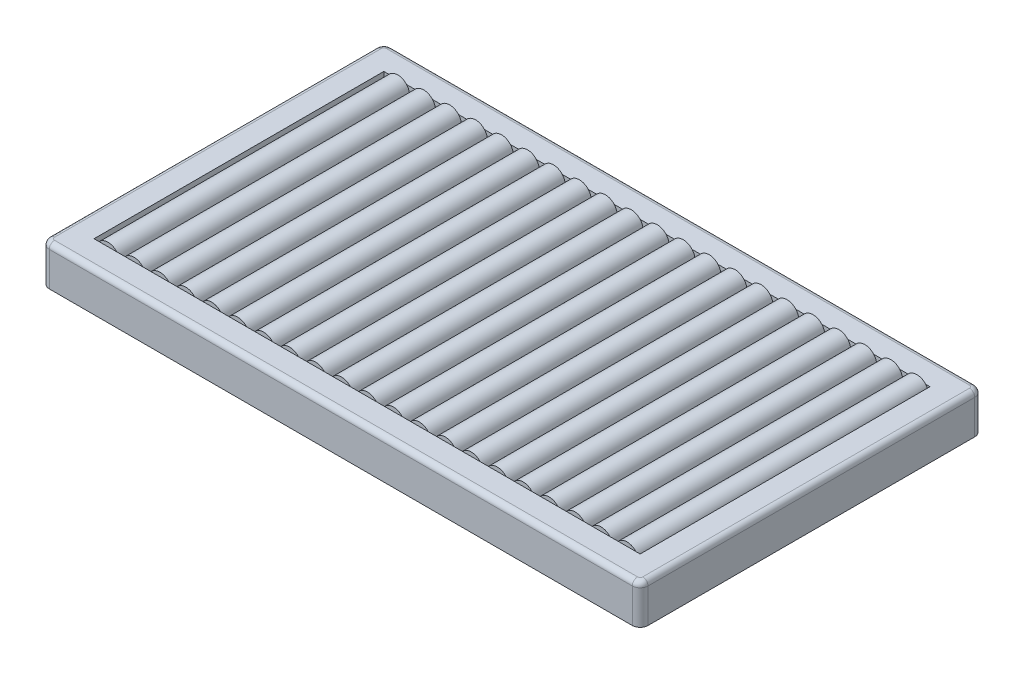
from build123d import *

# Parameters (mm, degrees)
SKETCH_1_R      = 1.5
EXTRUDE_1_DEPTH = 5
EXTRUDE_2_DEPTH = 10
FILLET_1_R      = 2
SKETCH_4_R      = 4.5
EXTRUDE_4_DEPTH = 110


with BuildPart() as part:
    # 草图1 → 凸台-拉伸1 (new body)
    with BuildSketch(Plane(origin=(0, 0, 0), x_dir=(1, 0, 0), z_dir=(0, 1, 0))):
        with BuildLine():
            Line((-65.462788351, 64.203800201), (-65.462788351, -59.796199799))
            ThreePointArc((-65.462788351, -59.796199799), (-64.584108695, -61.917520143), (-62.462788351, -62.796199799))
            Line((-62.462788351, -62.796199799), (158.823574937, -62.796199799))
            ThreePointArc((158.823574937, -62.796199799), (160.944895281, -61.917520143), (161.823574937, -59.796199799))
            Line((161.823574937, -59.796199799), (161.823574937, 64.203800201))
            ThreePointArc((161.823574937, 64.203800201), (160.944895281, 66.325120544), (158.823574937, 67.203800201))
            Line((158.823574937, 67.203800201), (-62.462788351, 67.203800201))
            ThreePointArc((-62.462788351, 67.203800201), (-64.584108695, 66.325120544), (-65.462788351, 64.203800201))
        make_face()
        with Locations(Location((-11.819606707, -57.796199799, 0), (0, 0, 270))):
            Circle(SKETCH_1_R, mode=Mode.SUBTRACT)
        with Locations(Location((108.180393293, -57.796199799, 0), (0, 0, 90))):
            Circle(SKETCH_1_R, mode=Mode.SUBTRACT)
        with Locations(Location((108.180393293, 62.203800201, 0), (0, 0, 270))):
            Circle(SKETCH_1_R, mode=Mode.SUBTRACT)
        with Locations(Location((-11.819606707, 62.203800201, 0), (0, 0, 90))):
            Circle(SKETCH_1_R, mode=Mode.SUBTRACT)
    extrude(amount=EXTRUDE_1_DEPTH)

    # 草图2 → 凸台-拉伸2 (add)
    with BuildSketch(Plane(origin=(0, 5, 0), x_dir=(1, 0, 0), z_dir=(0, 1, 0))):
        with BuildLine():
            Line((48.180393293, -62.796199799), (158.823574937, -62.796199799))
            ThreePointArc((158.823574937, -62.796199799), (160.944895281, -61.917520143), (161.823574937, -59.796199799))
            Line((161.823574937, -59.796199799), (161.823574937, 64.203800201))
            ThreePointArc((161.823574937, 64.203800201), (160.944895281, 66.325120544), (158.823574937, 67.203800201))
            Line((158.823574937, 67.203800201), (-62.462788351, 67.203800201))
            ThreePointArc((-62.462788351, 67.203800201), (-64.584108695, 66.325120544), (-65.462788351, 64.203800201))
            Line((-65.462788351, 64.203800201), (-65.462788351, -59.796199799))
            ThreePointArc((-65.462788351, -59.796199799), (-64.584108695, -61.917520143), (-62.462788351, -62.796199799))
            Line((-62.462788351, -62.796199799), (48.180393293, -62.796199799))
        make_face()
        Polygon((48.180393293, -52.796199799), (151.823574937, -52.796199799), (151.823574937, 57.203800201), (-55.462788351, 57.203800201), (-55.462788351, -52.796199799), align=None, mode=Mode.SUBTRACT)
    extrude(amount=EXTRUDE_2_DEPTH)

    # 圆角1
    fillet_1_edges = [part.edges().sort_by_distance(p)[0] for p in [
        (48.180393293, 15, 62.796199799),
        (160.944895281, 15, 61.917520143),
        (161.823574937, 15, -2.203800201),
        (160.944895281, 15, -66.325120544),
        (48.180393293, 15, -67.203800201),
        (-64.584108695, 15, -66.325120544),
        (-65.462788351, 15, -2.203800201),
        (-64.584108695, 15, 61.917520143),
    ]]
    fillet(fillet_1_edges, radius=FILLET_1_R)

    # 草图4 → 凸台-拉伸4 (add)
    with BuildSketch(Plane(origin=(0, 0, 52.796199799), x_dir=(-1, 0, 0), z_dir=(0, 0, -1))):
        with Locations(Location((-146.823574937, 12, 0), (0, 0, 138.189685104))):
            Circle(SKETCH_4_R)
        with Locations(Location((-136.973574937, 12, 0), (0, 0, 138.189685104))):
            Circle(SKETCH_4_R)
        with Locations(Location((-127.123574937, 12, 0), (0, 0, 138.189685104))):
            Circle(SKETCH_4_R)
        with Locations(Location((-117.273574937, 12, 0), (0, 0, 138.189685104))):
            Circle(SKETCH_4_R)
        with Locations(Location((-107.423574937, 12, 0), (0, 0, 138.189685104))):
            Circle(SKETCH_4_R)
        with Locations(Location((-97.573574937, 12, 0), (0, 0, 138.189685104))):
            Circle(SKETCH_4_R)
        with Locations(Location((-87.723574937, 12, 0), (0, 0, 138.189685104))):
            Circle(SKETCH_4_R)
        with Locations(Location((-77.873574937, 12, 0), (0, 0, 138.189685104))):
            Circle(SKETCH_4_R)
        with Locations(Location((-68.023574937, 12, 0), (0, 0, 138.189685104))):
            Circle(SKETCH_4_R)
        with Locations(Location((-58.173574937, 12, 0), (0, 0, 138.189685104))):
            Circle(SKETCH_4_R)
        with Locations(Location((-48.323574937, 12, 0), (0, 0, 138.189685104))):
            Circle(SKETCH_4_R)
        with Locations(Location((-38.473574937, 12, 0), (0, 0, 138.189685104))):
            Circle(SKETCH_4_R)
        with Locations(Location((-28.623574937, 12, 0), (0, 0, 138.189685104))):
            Circle(SKETCH_4_R)
        with Locations(Location((-18.773574937, 12, 0), (0, 0, 138.189685104))):
            Circle(SKETCH_4_R)
        with Locations(Location((-8.923574937, 12, 0), (0, 0, 138.189685104))):
            Circle(SKETCH_4_R)
        with Locations(Location((0.926425063, 12, 0), (0, 0, 138.189685104))):
            Circle(SKETCH_4_R)
        with Locations(Location((10.776425063, 12, 0), (0, 0, 138.189685104))):
            Circle(SKETCH_4_R)
        with Locations(Location((20.626425063, 12, 0), (0, 0, 138.189685104))):
            Circle(SKETCH_4_R)
        with Locations(Location((30.476425063, 12, 0), (0, 0, 138.189685104))):
            Circle(SKETCH_4_R)
        with Locations(Location((40.326425063, 12, 0), (0, 0, 138.189685104))):
            Circle(SKETCH_4_R)
        with Locations(Location((50.176425063, 12, 0), (0, 0, 138.189685104))):
            Circle(SKETCH_4_R)
    extrude(amount=EXTRUDE_4_DEPTH)


solid = part.part
